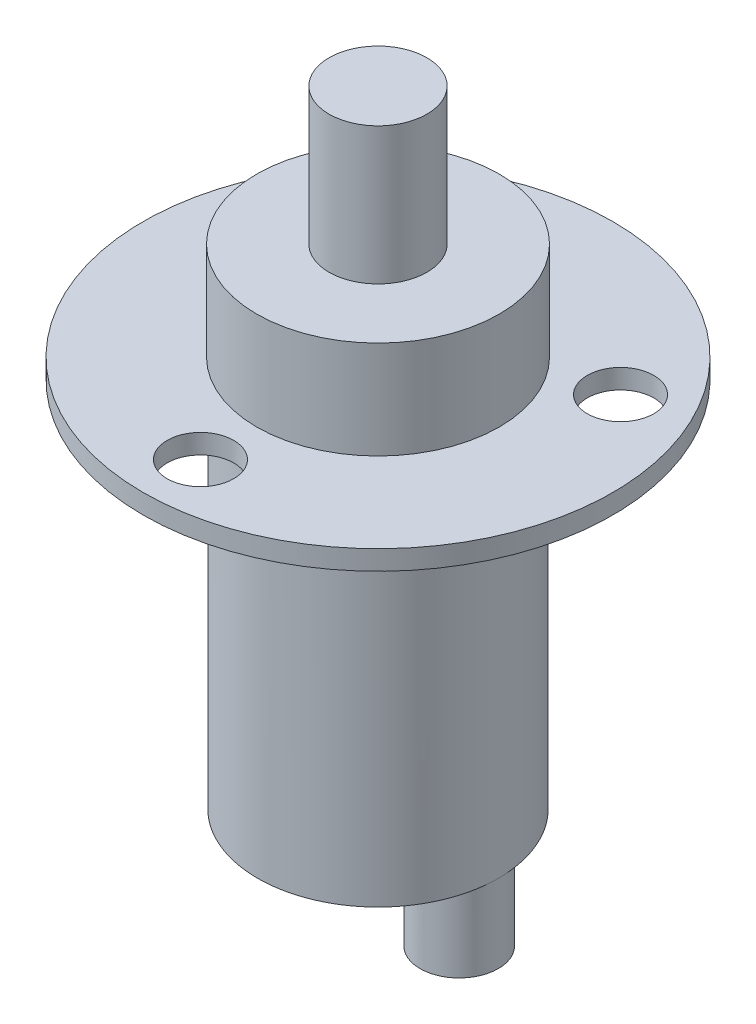
from build123d import *

# Parameters (mm, degrees)
SKETCH1_R           = 6.15
BOSS_EXTRUDE1_DEPTH = 19
SKETCH2_R           = 12
BOSS_EXTRUDE2_DEPTH = 1
SKETCH3_R           = 6.2
BOSS_EXTRUDE3_DEPTH = 5
SKETCH4_R           = 2.5
BOSS_EXTRUDE4_DEPTH = 7
SKETCH5_R           = 2
BOSS_EXTRUDE5_DEPTH = 4
SKETCH6_R           = 1.7
CUT_EXTRUDE1_DEPTH  = 29.583211856


with BuildPart() as part:
    # Sketch1 → Boss-Extrude1 (new body)
    with BuildSketch(Plane(origin=(0, 0, 0), x_dir=(1, 0, 0), z_dir=(0, 1, 0))):
        with Locations(Location((0, 0, 0), (0, 0, 270))):
            Circle(SKETCH1_R)
    extrude(amount=BOSS_EXTRUDE1_DEPTH)

    # Sketch2 → Boss-Extrude2 (add)
    with BuildSketch(Plane(origin=(0, 19, 0), x_dir=(1, 0, 0), z_dir=(0, 1, 0))):
        with Locations(Location((0, 0, 0), (0, 0, 270))):
            Circle(SKETCH2_R)
    extrude(amount=BOSS_EXTRUDE2_DEPTH)

    # Sketch3 → Boss-Extrude3 (add)
    with BuildSketch(Plane(origin=(0, 20, 0), x_dir=(1, 0, 0), z_dir=(0, 1, 0))):
        with Locations(Location((0, 0, 0), (0, 0, 270))):
            Circle(SKETCH3_R)
    extrude(amount=BOSS_EXTRUDE3_DEPTH)

    # Sketch4 → Boss-Extrude4 (add)
    with BuildSketch(Plane(origin=(0, 25, 0), x_dir=(1, 0, 0), z_dir=(0, 1, 0))):
        with Locations(Location((0, 0, 0), (0, 0, 270))):
            Circle(SKETCH4_R)
    extrude(amount=BOSS_EXTRUDE4_DEPTH)

    # Sketch5 → Boss-Extrude5 (add)
    with BuildSketch(Plane.XZ):
        with Locations(Location((-4.15, 0, 0), (0, 0, 179.999302513))):
            Circle(SKETCH5_R)
        with Locations(Location((4.15, 0, 0), (0, 0, 359.999302513))):
            Circle(SKETCH5_R)
    extrude(amount=BOSS_EXTRUDE5_DEPTH)

    # Sketch6 → Cut-Extrude1 (cut, through all)
    with BuildSketch(Plane.XZ.offset(-19)):
        with Locations(Location((0, 9.075, 0), (0, 0, 270))):
            Circle(SKETCH6_R)
        with Locations(Location((7.859180539, -4.5375, 0), (0, 0, 270))):
            Circle(SKETCH6_R)
        with Locations(Location((-7.859180539, -4.5375, 0), (0, 0, 270))):
            Circle(SKETCH6_R)
    extrude(amount=-CUT_EXTRUDE1_DEPTH, mode=Mode.SUBTRACT)


solid = part.part
